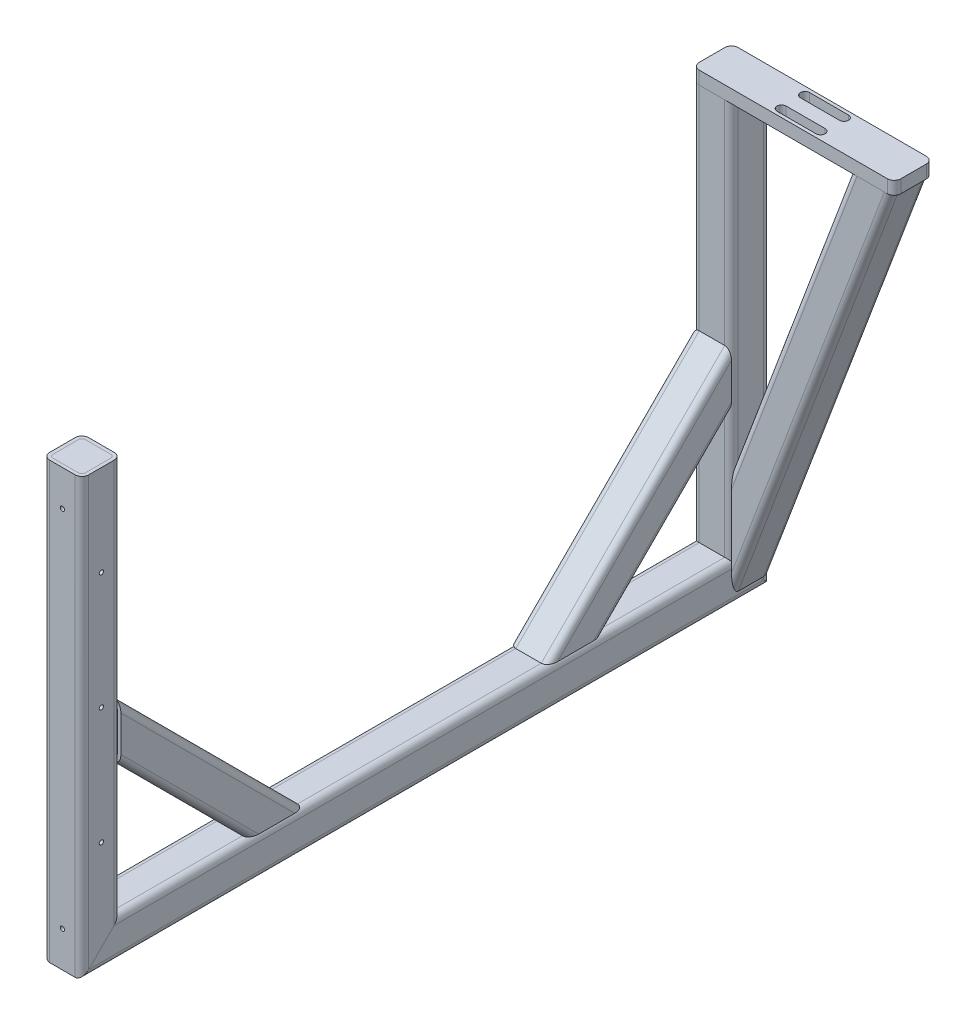
from build123d import *

# Parameters (mm, degrees)
MEMBER_1_DEPTH                        = 342.213203436
MEMBER_1_2_DEPTH                      = 544.426406871
MEMBER_1_3_DEPTH                      = 342.213203436
MEMBER_2_DEPTH                        = 212.132034356
MEMBER_3_DEPTH                        = 212.132034356
EXTRUDE_1_DEPTH                       = 10
MEMBER_5_DEPTH                        = 304.494400605
WELD_TRIM_1_EXTEND_1_RUN_ON           = 39.878731
WELD_TRIM_1_EXTEND_1_OTHER_END_RUN_ON = 5.642105
CUT_EXTRUDE_1_DEPTH                   = 10
EXTRUDE_2_DEPTH                       = 2
SKETCH_11_W                           = 1.65
SKETCH_11_H                           = 2.6
HOLE_WIZARD_M4_1_AT_2_COUNT           = 2
HOLE_WIZARD_M4_1_AT_2_PITCH           = 280
HOLE_WIZARD_M4_2_AT_2_COUNT           = 2
HOLE_WIZARD_M4_2_AT_2_PITCH           = 90
HOLE_WIZARD_M4_2_AT_3_COUNT           = 2
HOLE_WIZARD_M4_2_AT_3_PITCH           = 180


with BuildPart() as part:
    # Sketch1 → Member 1 (new body)
    with BuildSketch(Plane.XZ):
        with BuildLine():
            Line((-9.8, -15), (9.8, -15))
            ThreePointArc((9.8, -15), (13.476955262, -13.476955262), (15, -9.8))
            Line((15, -9.8), (15, 9.8))
            ThreePointArc((15, 9.8), (13.476955262, 13.476955262), (9.8, 15))
            Line((9.8, 15), (-9.8, 15))
            ThreePointArc((-9.8, 15), (-13.476955262, 13.476955262), (-15, 9.8))
            Line((-15, 9.8), (-15, -9.8))
            ThreePointArc((-15, -9.8), (-13.476955262, -13.476955262), (-9.8, -15))
        make_face()
        with BuildLine():
            Line((-9.8, -12.4), (9.8, -12.4))
            ThreePointArc((9.8, -12.4), (11.638477631, -11.638477631), (12.4, -9.8))
            Line((12.4, -9.8), (12.4, 9.8))
            ThreePointArc((12.4, 9.8), (11.638477631, 11.638477631), (9.8, 12.4))
            Line((9.8, 12.4), (-9.8, 12.4))
            ThreePointArc((-9.8, 12.4), (-11.638477631, 11.638477631), (-12.4, 9.8))
            Line((-12.4, 9.8), (-12.4, -9.8))
            ThreePointArc((-12.4, -9.8), (-11.638477631, -11.638477631), (-9.8, -12.4))
        make_face(mode=Mode.SUBTRACT)
    extrude(amount=MEMBER_1_DEPTH)

    # Member 1 mitre 1
    split(bisect_by=Plane(origin=(0, -320, 0), x_dir=(-1, 0, 0), z_dir=(0, 0.707106781, -0.707106781)), keep=Keep.TOP)


with BuildPart() as body_2:
    # Sketch1 on segment 2 (carried to segment 2) → Member 1 2 (new body)
    with BuildSketch(Plane(origin=(0, -320, -22.213203436), x_dir=(1, 0, 0), z_dir=(0, 0, 1))):
        with BuildLine():
            Line((-9.8, -15), (9.8, -15))
            ThreePointArc((9.8, -15), (13.476955262, -13.476955262), (15, -9.8))
            Line((15, -9.8), (15, 9.8))
            ThreePointArc((15, 9.8), (13.476955262, 13.476955262), (9.8, 15))
            Line((9.8, 15), (-9.8, 15))
            ThreePointArc((-9.8, 15), (-13.476955262, 13.476955262), (-15, 9.8))
            Line((-15, 9.8), (-15, -9.8))
            ThreePointArc((-15, -9.8), (-13.476955262, -13.476955262), (-9.8, -15))
        make_face()
        with BuildLine():
            Line((-9.8, -12.4), (9.8, -12.4))
            ThreePointArc((9.8, -12.4), (11.638477631, -11.638477631), (12.4, -9.8))
            Line((12.4, -9.8), (12.4, 9.8))
            ThreePointArc((12.4, 9.8), (11.638477631, 11.638477631), (9.8, 12.4))
            Line((9.8, 12.4), (-9.8, 12.4))
            ThreePointArc((-9.8, 12.4), (-11.638477631, 11.638477631), (-12.4, 9.8))
            Line((-12.4, 9.8), (-12.4, -9.8))
            ThreePointArc((-12.4, -9.8), (-11.638477631, -11.638477631), (-9.8, -12.4))
        make_face(mode=Mode.SUBTRACT)
    extrude(amount=MEMBER_1_2_DEPTH)

    # Member 1 2 mitre 1
    split(bisect_by=Plane(origin=(0, -320, 0), x_dir=(1, 0, 0), z_dir=(0, -0.707106781, 0.707106781)), keep=Keep.TOP)

    # Member 1 2 mitre 2
    split(bisect_by=Plane(origin=(0, -320, 500), x_dir=(1, 0, 0), z_dir=(0, -0.707106781, -0.707106781)), keep=Keep.TOP)


with BuildPart() as body_3:
    # Sketch1 on segment 3 (carried to segment 3) → Member 1 3 (new body)
    with BuildSketch(Plane(origin=(0, -342.213203436, 500), x_dir=(1, 0, 0), z_dir=(0, 1, 0))):
        with BuildLine():
            Line((-9.8, -15), (9.8, -15))
            ThreePointArc((9.8, -15), (13.476955262, -13.476955262), (15, -9.8))
            Line((15, -9.8), (15, 9.8))
            ThreePointArc((15, 9.8), (13.476955262, 13.476955262), (9.8, 15))
            Line((9.8, 15), (-9.8, 15))
            ThreePointArc((-9.8, 15), (-13.476955262, 13.476955262), (-15, 9.8))
            Line((-15, 9.8), (-15, -9.8))
            ThreePointArc((-15, -9.8), (-13.476955262, -13.476955262), (-9.8, -15))
        make_face()
        with BuildLine():
            Line((-9.8, -12.4), (9.8, -12.4))
            ThreePointArc((9.8, -12.4), (11.638477631, -11.638477631), (12.4, -9.8))
            Line((12.4, -9.8), (12.4, 9.8))
            ThreePointArc((12.4, 9.8), (11.638477631, 11.638477631), (9.8, 12.4))
            Line((9.8, 12.4), (-9.8, 12.4))
            ThreePointArc((-9.8, 12.4), (-11.638477631, 11.638477631), (-12.4, 9.8))
            Line((-12.4, 9.8), (-12.4, -9.8))
            ThreePointArc((-12.4, -9.8), (-11.638477631, -11.638477631), (-9.8, -12.4))
        make_face(mode=Mode.SUBTRACT)
    extrude(amount=MEMBER_1_3_DEPTH)

    # Member 1 3 mitre 1
    split(bisect_by=Plane(origin=(0, -320, 500), x_dir=(-1, 0, 0), z_dir=(0, 0.707106781, 0.707106781)), keep=Keep.TOP)

    # 草图11 → M4 螺纹孔1 (revolve, cut)
    with BuildSketch(Plane(origin=(0, -27.5, 515), x_dir=(0, -1, 0), z_dir=(1, 0, 0))):
        with Locations((0.825, 1.3)):
            Rectangle(SKETCH_11_W, SKETCH_11_H)
    hole_wizard_m4_1 = revolve(axis=Axis((0, -27.5, 521.35), (0, 0, -1)), mode=Mode.SUBTRACT)

    # M4 螺纹孔1 at 2: M4 螺纹孔1 ×2
    with Locations(*[(0, -i * HOLE_WIZARD_M4_1_AT_2_PITCH, 0) for i in range(1, HOLE_WIZARD_M4_1_AT_2_COUNT)]):
        add(hole_wizard_m4_1, mode=Mode.SUBTRACT)

    # 草图14 → M4 螺纹孔2 (revolve, cut)
    with BuildSketch(Plane(origin=(15, -70, 500), x_dir=(0, 0, -1), z_dir=(0, 1, 0))):
        Polygon((0, 0), (0, 11.091420021), (1.65, 10.1), (1.65, 0), align=None)
    hole_wizard_m4_2 = revolve(axis=Axis((21.35, -70, 500), (-1, 0, 0)), mode=Mode.SUBTRACT)

    # M4 螺纹孔2 at 2: M4 螺纹孔2 ×2
    with Locations(*[(0, -i * HOLE_WIZARD_M4_2_AT_2_PITCH, 0) for i in range(1, HOLE_WIZARD_M4_2_AT_2_COUNT)]):
        add(hole_wizard_m4_2, mode=Mode.SUBTRACT)

    # M4 螺纹孔2 at 3: M4 螺纹孔2 ×2
    with Locations(*[(0, -i * HOLE_WIZARD_M4_2_AT_3_PITCH, 0) for i in range(1, HOLE_WIZARD_M4_2_AT_3_COUNT)]):
        add(hole_wizard_m4_2, mode=Mode.SUBTRACT)


with BuildPart() as body_4:
    # Sketch11 → Member 2 (new body)
    with BuildSketch(Plane(origin=(0, -170, 500), x_dir=(1, 0, 0), z_dir=(0, -0.7071067811865507, -0.7071067811865444))):
        with BuildLine():
            Line((-9.8, -15), (9.8, -15))
            ThreePointArc((9.8, -15), (13.476955262, -13.476955262), (15, -9.8))
            Line((15, -9.8), (15, 9.8))
            ThreePointArc((15, 9.8), (13.476955262, 13.476955262), (9.8, 15))
            Line((9.8, 15), (-9.8, 15))
            ThreePointArc((-9.8, 15), (-13.476955262, 13.476955262), (-15, 9.8))
            Line((-15, 9.8), (-15, -9.8))
            ThreePointArc((-15, -9.8), (-13.476955262, -13.476955262), (-9.8, -15))
        make_face()
        with BuildLine():
            Line((-9.8, -12.4), (9.8, -12.4))
            ThreePointArc((9.8, -12.4), (11.638477631, -11.638477631), (12.4, -9.8))
            Line((12.4, -9.8), (12.4, 9.8))
            ThreePointArc((12.4, 9.8), (11.638477631, 11.638477631), (9.8, 12.4))
            Line((9.8, 12.4), (-9.8, 12.4))
            ThreePointArc((-9.8, 12.4), (-11.638477631, 11.638477631), (-12.4, 9.8))
            Line((-12.4, 9.8), (-12.4, -9.8))
            ThreePointArc((-12.4, -9.8), (-11.638477631, -11.638477631), (-9.8, -12.4))
        make_face(mode=Mode.SUBTRACT)
    extrude(amount=MEMBER_2_DEPTH)

    # Weld Trim 3
    split(bisect_by=Plane(origin=(0, -305, 250), x_dir=(-1, 0, 0), z_dir=(0, 1, 0)), keep=Keep.TOP)

    # Weld Trim 3 3
    split(bisect_by=Plane(origin=(0, -152.5, 485), x_dir=(0, 1, 0), z_dir=(0, 0, -1)), keep=Keep.TOP)


with BuildPart() as body_5:
    # Sketch12 → Member 3 (new body)
    with BuildSketch(Plane(origin=(0, -170, 0), x_dir=(1, 0, 0), z_dir=(0, -0.7071067811865442, 0.7071067811865508))):
        with BuildLine():
            Line((-9.8, -15), (9.8, -15))
            ThreePointArc((9.8, -15), (13.476955262, -13.476955262), (15, -9.8))
            Line((15, -9.8), (15, 9.8))
            ThreePointArc((15, 9.8), (13.476955262, 13.476955262), (9.8, 15))
            Line((9.8, 15), (-9.8, 15))
            ThreePointArc((-9.8, 15), (-13.476955262, 13.476955262), (-15, 9.8))
            Line((-15, 9.8), (-15, -9.8))
            ThreePointArc((-15, -9.8), (-13.476955262, -13.476955262), (-9.8, -15))
        make_face()
        with BuildLine():
            Line((-9.8, -12.4), (9.8, -12.4))
            ThreePointArc((9.8, -12.4), (11.638477631, -11.638477631), (12.4, -9.8))
            Line((12.4, -9.8), (12.4, 9.8))
            ThreePointArc((12.4, 9.8), (11.638477631, 11.638477631), (9.8, 12.4))
            Line((9.8, 12.4), (-9.8, 12.4))
            ThreePointArc((-9.8, 12.4), (-11.638477631, 11.638477631), (-12.4, 9.8))
            Line((-12.4, 9.8), (-12.4, -9.8))
            ThreePointArc((-12.4, -9.8), (-11.638477631, -11.638477631), (-9.8, -12.4))
        make_face(mode=Mode.SUBTRACT)
    extrude(amount=MEMBER_3_DEPTH)

    # Weld Trim 2
    split(bisect_by=Plane(origin=(0, -152.5, 15), x_dir=(0, -1, 0), z_dir=(0, 0, 1)), keep=Keep.TOP)

    # Weld Trim 2 3
    split(bisect_by=Plane(origin=(0, -305, 250), x_dir=(-1, 0, 0), z_dir=(0, 1, 0)), keep=Keep.TOP)


with BuildPart() as body_6:
    # 草图5 → 凸台-拉伸1 (new body)
    with BuildSketch(Plane(origin=(0, 0, 0), x_dir=(1, 0, 0), z_dir=(0, 1, 0))):
        with BuildLine():
            Line((135, -15), (-9.8, -15))
            ThreePointArc((-9.8, -15), (-13.476955262, -13.476955262), (-15, -9.8))
            Line((-15, -9.8), (-15, 9.8))
            ThreePointArc((-15, 9.8), (-13.476955262, 13.476955262), (-9.8, 15))
            Line((-9.8, 15), (135, 15))
            ThreePointArc((135, 15), (138.676955262, 13.476955262), (140.2, 9.8))
            Line((140.2, 9.8), (140.2, -9.8))
            ThreePointArc((140.2, -9.8), (138.676955262, -13.476955262), (135, -15))
        make_face()
    extrude(amount=EXTRUDE_1_DEPTH)

    # 草图13 → 切除-拉伸1 (cut)
    with BuildSketch(Plane(origin=(0, 10, 0), x_dir=(1, 0, 0), z_dir=(0, 1, 0))):
        with BuildLine():
            Line((47.6, 12.5), (77.6, 12.5))
            ThreePointArc((77.6, 12.5), (81.1, 9), (77.6, 5.5))
            Line((77.6, 5.5), (47.6, 5.5))
            ThreePointArc((47.6, 5.5), (44.1, 9), (47.6, 12.5))
        make_face()
        with BuildLine():
            Line((47.6, -12.5), (77.6, -12.5))
            ThreePointArc((77.6, -12.5), (81.1, -9), (77.6, -5.5))
            Line((77.6, -5.5), (47.6, -5.5))
            ThreePointArc((47.6, -5.5), (44.1, -9), (47.6, -12.5))
        make_face()
    extrude(amount=-CUT_EXTRUDE_1_DEPTH, mode=Mode.SUBTRACT)


with BuildPart() as body_7:
    # Sketch14 → Member 5 (new body)
    with BuildSketch(Plane(origin=(122.2, 0, 0), x_dir=(0.9359778026572028, -0.35205901910474424, 0), z_dir=(-0.35205901910474424, -0.9359778026572028, 0))):
        with BuildLine():
            Line((-9.8, -15), (9.8, -15))
            ThreePointArc((9.8, -15), (13.476955262, -13.476955262), (15, -9.8))
            Line((15, -9.8), (15, 9.8))
            ThreePointArc((15, 9.8), (13.476955262, 13.476955262), (9.8, 15))
            Line((9.8, 15), (-9.8, 15))
            ThreePointArc((-9.8, 15), (-13.476955262, 13.476955262), (-15, 9.8))
            Line((-15, 9.8), (-15, -9.8))
            ThreePointArc((-15, -9.8), (-13.476955262, -13.476955262), (-9.8, -15))
        make_face()
        with BuildLine():
            Line((-9.8, -12.4), (9.8, -12.4))
            ThreePointArc((9.8, -12.4), (11.638477631, -11.638477631), (12.4, -9.8))
            Line((12.4, -9.8), (12.4, 9.8))
            ThreePointArc((12.4, 9.8), (11.638477631, 11.638477631), (9.8, 12.4))
            Line((9.8, 12.4), (-9.8, 12.4))
            ThreePointArc((-9.8, 12.4), (-11.638477631, 11.638477631), (-12.4, 9.8))
            Line((-12.4, 9.8), (-12.4, -9.8))
            ThreePointArc((-12.4, -9.8), (-11.638477631, -11.638477631), (-9.8, -12.4))
        make_face(mode=Mode.SUBTRACT)
    extrude(amount=MEMBER_5_DEPTH)

    # Weld Trim 1 extend 1: the member runs on so that the trim can cut it back to the boundary (SolidWorks' 'allow extension')
    extrude(body_7.faces().sort_by_distance((3.768266368, -280.77529177, -12))[0], amount=WELD_TRIM_1_EXTEND_1_RUN_ON, dir=(-0.352059019, -0.935977803, 0))

    # Weld Trim 1 extend 1 other end: the member runs on so that the trim can cut it back to the boundary (SolidWorks' 'allow extension')
    extrude(body_7.faces().sort_by_distance((110.968266368, 4.224708229, -12))[0], amount=WELD_TRIM_1_EXTEND_1_OTHER_END_RUN_ON, dir=(0.352059019, 0.935977803, 0))

    # Weld Trim 1
    split(bisect_by=Plane(origin=(15, -160.050020833, -0.100041667), x_dir=(0, 1, 0), z_dir=(1, 0, 0)), keep=Keep.TOP)

    # Weld Trim 1 3
    split(bisect_by=Plane(origin=(62.6, 0, 0), x_dir=(1, 0, 0), z_dir=(0, -1, 0)), keep=Keep.TOP)


with BuildPart() as body_8:
    # 草图10 → 凸台-拉伸2 (new body)
    with BuildSketch(Plane(origin=(0, 0, 0), x_dir=(1, 0, 0), z_dir=(0, 1, 0))):
        with BuildLine():
            Line((9.8, -487.6), (-9.8, -487.6))
            ThreePointArc((-9.8, -487.6), (-11.638477631, -488.361522369), (-12.4, -490.2))
            Line((-12.4, -490.2), (-12.4, -509.8))
            ThreePointArc((-12.4, -509.8), (-11.638477631, -511.638477631), (-9.8, -512.4))
            Line((-9.8, -512.4), (9.8, -512.4))
            ThreePointArc((9.8, -512.4), (11.638477631, -511.638477631), (12.4, -509.8))
            Line((12.4, -509.8), (12.4, -490.2))
            ThreePointArc((12.4, -490.2), (11.638477631, -488.361522369), (9.8, -487.6))
        make_face()
    extrude(amount=-EXTRUDE_2_DEPTH)


solid = Compound([part.part, body_2.part, body_3.part, body_4.part, body_5.part, body_6.part, body_7.part, body_8.part])
